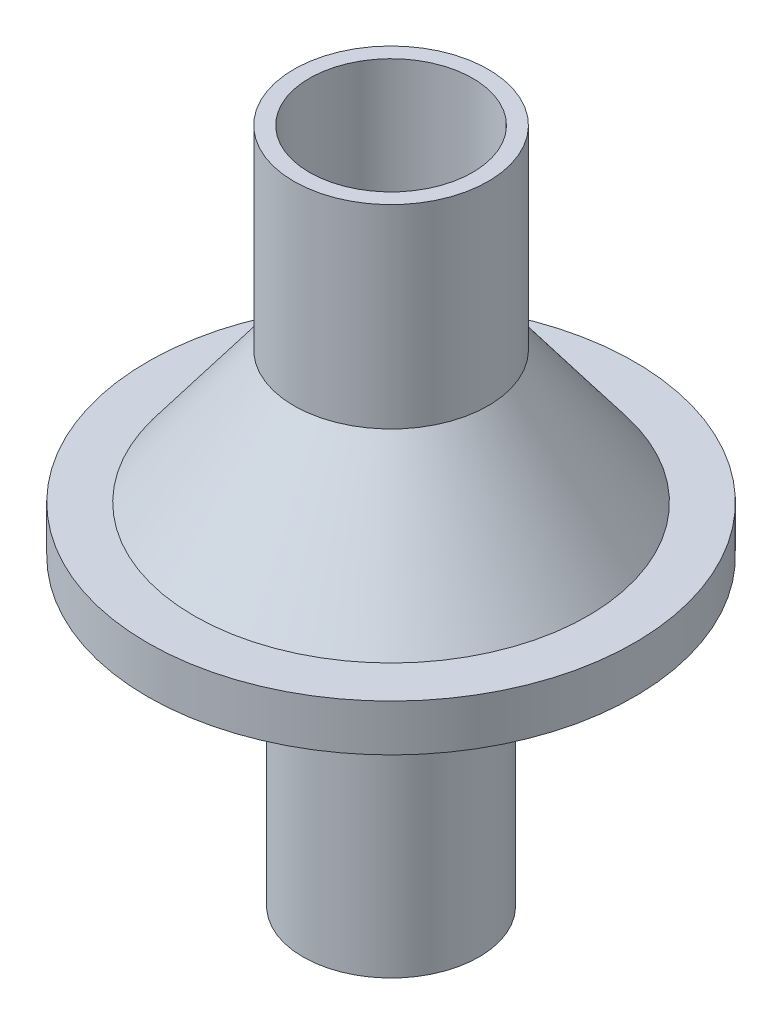
from build123d import *

# Parameters (mm, degrees)
SKETCH1_R           = 11.325
SKETCH1_R_2         = 9.325
BOSS_EXTRUDE1_DEPTH = 25


with BuildPart() as part:
    # Sketch1 → Boss-Extrude1 (new body)
    with BuildSketch(Plane(origin=(0, 0, 0), x_dir=(1, 0, 0), z_dir=(0, 1, 0))):
        with Locations(Location((0, 0, 0), (0, 0, 270))):
            Circle(SKETCH1_R)
        with Locations(Location((0, 0, 0), (0, 0, 270))):
            Circle(SKETCH1_R_2, mode=Mode.SUBTRACT)
    extrude(amount=BOSS_EXTRUDE1_DEPTH)

    # Sketch10 → Revolve1 (revolve)
    with BuildSketch(Plane.XY, mode=Mode.PRIVATE) as revolve1_sk:
        Polygon((-11.325, 25), (-25.325, 39), (-31.325, 39), (-31.325, 42), (-25.325, 42), (-9.325, 25), align=None)
    revolve(revolve1_sk.sketch.rotate(Axis((0, 25, 0), (0, -1, 0)), 270), axis=Axis((0, 25, 0), (0, -1, 0)))

    # Sketch11 → Revolve2 (revolve)
    with BuildSketch(Plane.XY, mode=Mode.PRIVATE) as revolve2_sk:
        Polygon((-31.325, 42), (-31.325, 45), (-25.325, 45), (-12.5, 62), (-12.5, 87), (-10.5, 87), (-10.5, 62), (-25.325, 42), align=None)
    revolve(revolve2_sk.sketch.rotate(Axis((0, 25, 0), (0, -1, 0)), 270), axis=Axis((0, 25, 0), (0, -1, 0)))


solid = part.part
